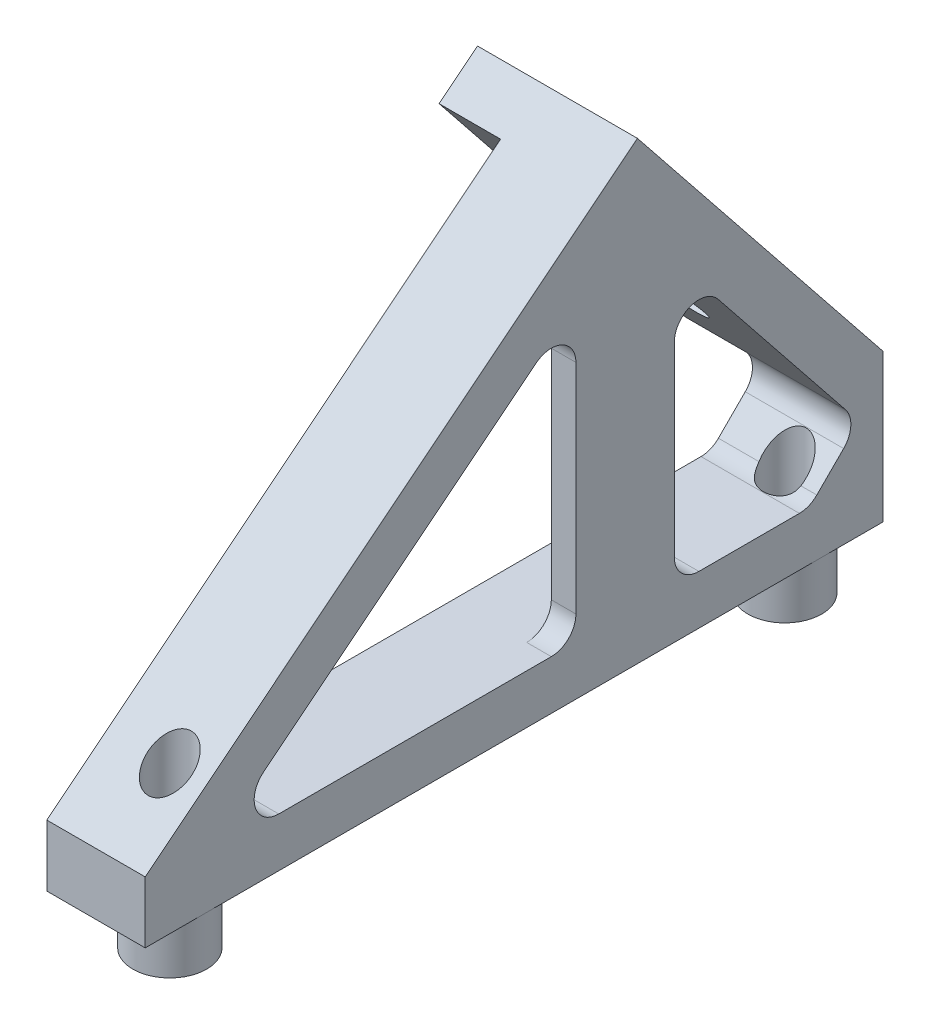
from build123d import *

# Parameters (mm, degrees)
EXTRUDE_1_DEPTH     = 13
CUT_EXTRUDE_1_DEPTH = 49.78979572841993
CUT_EXTRUDE_2_DEPTH = 72.67669327248296
FILLET_1_R          = 2
CUT_EXTRUDE_3_DEPTH = 13
SKETCH_8_R          = 2.000000000000001
SKETCH_8_R_2        = 2.0000000000000018
CUT_EXTRUDE_4_DEPTH = 13
CUT_EXTRUDE_5_DEPTH = 6
SKETCH_10_R         = 3
SKETCH_10_R_2       = 3.0000000000000013
EXTRUDE_2_DEPTH     = 4
CUT_EXTRUDE_6_REACH = 75.821
SKETCH_11_R         = 1.7500000000000004
SKETCH_11_R_2       = 1.7499999999999998


with BuildPart() as part:
    # 草圖4 → 填料-伸長1 (new body)
    with BuildSketch(Plane(origin=(0, 0, 0), x_dir=(0, 0, -1), z_dir=(1, 0, 0))):
        Polygon((0, 0), (-60, -7.35e-15), (-60, 4.999999999999993), (-19.982621227151128, 36.9938962327247), (6e-16, 12), align=None)
    extrude(amount=EXTRUDE_1_DEPTH)

    # 草圖5 → 除料-伸長1 (cut, through all)
    with BuildSketch(Plane(origin=(0, 32.31453899318016, 25.83547546241596), x_dir=(1, 0, 0), z_dir=(0, 0.7810592572726445, 0.6244569133484753))):
        Polygon((0, 3.4934829601818222), (5, 3.4934829601818222), (5.000000000000004, -49.04518650741456), (0, -49.04518650741456), align=None)
    extrude(amount=-CUT_EXTRUDE_1_DEPTH, mode=Mode.SUBTRACT)

    # 草圖6 → 除料-伸長2 (cut, through all)
    with BuildSketch(Plane(origin=(13, 0, 0), x_dir=(0, 0, -1), z_dir=(1, 0, 0))):
        Polygon((-24.98262122715113, 27.87514563803557), (-24.982621227151125, 3.9999999999999933), (-54.84521562029527, 3.99999999999999), align=None)
        Polygon((-16.982621227151128, 26.835985196390023), (-1.9496281407001657, 8.032993086450977), (-5.982621227151128, 3.9999999999999964), (-16.982621227151128, 3.9999999999999942), align=None)
    extrude(amount=-CUT_EXTRUDE_2_DEPTH, mode=Mode.SUBTRACT)

    # 圓角1
    fillet_1_edges = [part.edges().sort_by_distance(p)[0] for p in [
        (9.000000000000002, 3.99999999999999, 54.84521562029527),
        (9, 27.87514563803557, 24.98262122715113),
        (9, 3.9999999999999933, 24.982621227151125),
        (9, 26.835985196390023, 16.982621227151128),
        (9, 3.9999999999999964, 5.982621227151128),
        (9, 3.9999999999999942, 16.982621227151128),
        (9, 8.032993086450977, 1.9496281407001657),
    ]]
    fillet(fillet_1_edges, radius=FILLET_1_R)

    # 草圖7 → 除料-伸長3 (cut)
    with BuildSketch(Plane(origin=(0, 2.181529586150628, -2.728617206174244), x_dir=(1, 0, 0), z_dir=(0, -0.6244569133484752, 0.7810592572726445))):
        Polygon((0, 9.372711087271734), (4.999999999999999, 9.372711087271734), (4.999999999999999, 4.369584430641977), (0, 4.369584430641976), align=None)
    extrude(amount=-CUT_EXTRUDE_3_DEPTH, mode=Mode.SUBTRACT)

    # 草圖8 → 除料-伸長4 (cut)
    with BuildSketch(Plane(origin=(0, 4.679357239544419, -5.852854235264727), x_dir=(-1, 0, 0), z_dir=(0, 0.6244569133484724, -0.7810592572726467))):
        with Locations(Location((-4, 34.372711087271774, 0), (0, 0, 90))):
            Circle(SKETCH_8_R)
        with Locations(Location((-4, 16.372711087271757, 0), (0, 0, 90))):
            Circle(SKETCH_8_R_2)
    extrude(amount=-CUT_EXTRUDE_4_DEPTH, mode=Mode.SUBTRACT)

    # 草圖9 → 除料-伸長5 (cut)
    with BuildSketch(Plane.ZY.offset(-5)):
        with BuildLine():
            Line((20.609030602847792, 31.371831550240223), (3.0671165568141214, 9.430727107234867))
            ThreePointArc((3.0671165568141214, 9.430727107234867), (2.632312431238594, 8.07090805355147), (3.215021508986313, 6.767599718164824))
            Line((3.215021508986313, 6.767599718164824), (5.396834789524223, 4.585786437626903))
            ThreePointArc((5.396834789524223, 4.585786437626903), (6.04568148716714, 4.1522409349774225), (6.811048351897321, 3.9999999999999956))
            Line((6.811048351897321, 3.9999999999999956), (49.14086927004922, 3.9999999999999907))
            ThreePointArc((49.14086927004922, 3.9999999999999907), (51.02822681819565, 5.338273859172296), (50.38978309674617, 7.56211851454527))
            Line((50.38978309674617, 7.56211851454527), (20.609030602847792, 31.371831550240223))
        make_face()
    extrude(amount=-CUT_EXTRUDE_5_DEPTH, mode=Mode.SUBTRACT)

    # 草圖10 → 填料-伸長2 (add)
    with BuildSketch(Plane.XZ):
        with Locations((9.999999999999998, 55)):
            Circle(SKETCH_10_R)
        with Locations((9.999999999999998, 5)):
            Circle(SKETCH_10_R_2)
    extrude(amount=EXTRUDE_2_DEPTH)

    # 草圖11 → 除料-伸長6 (cut, up to next)
    with BuildSketch(Plane(origin=(0, -4, -4.9e-16), x_dir=(-1, 0, 0), z_dir=(0, -1, -1.2e-16)), mode=Mode.PRIVATE) as cut_extrude_6_sk1:
        with Locations(Location((-9.999999999999998, -55, 0), (0, 0, 90))):
            Circle(SKETCH_11_R)
    cut_extrude_6_tool1 = extrude(cut_extrude_6_sk1.sketch, amount=-CUT_EXTRUDE_6_REACH, mode=Mode.PRIVATE) & part.part
    # 草圖11 → 除料-伸長6 (cut, up to next)
    with BuildSketch(Plane(origin=(0, -4, -4.9e-16), x_dir=(-1, 0, 0), z_dir=(0, -1, -1.2e-16)), mode=Mode.PRIVATE) as cut_extrude_6_sk2:
        with Locations(Location((-9.999999999999998, -5, 0), (0, 0, 90))):
            Circle(SKETCH_11_R_2)
    cut_extrude_6_tool2 = extrude(cut_extrude_6_sk2.sketch, amount=-CUT_EXTRUDE_6_REACH, mode=Mode.PRIVATE) & part.part
    add(cut_extrude_6_tool1.solids().sort_by_distance((10, -4, 55))[0], mode=Mode.SUBTRACT)
    add(cut_extrude_6_tool2.solids().sort_by_distance((10, -4, 5))[0], mode=Mode.SUBTRACT)


solid = part.part
